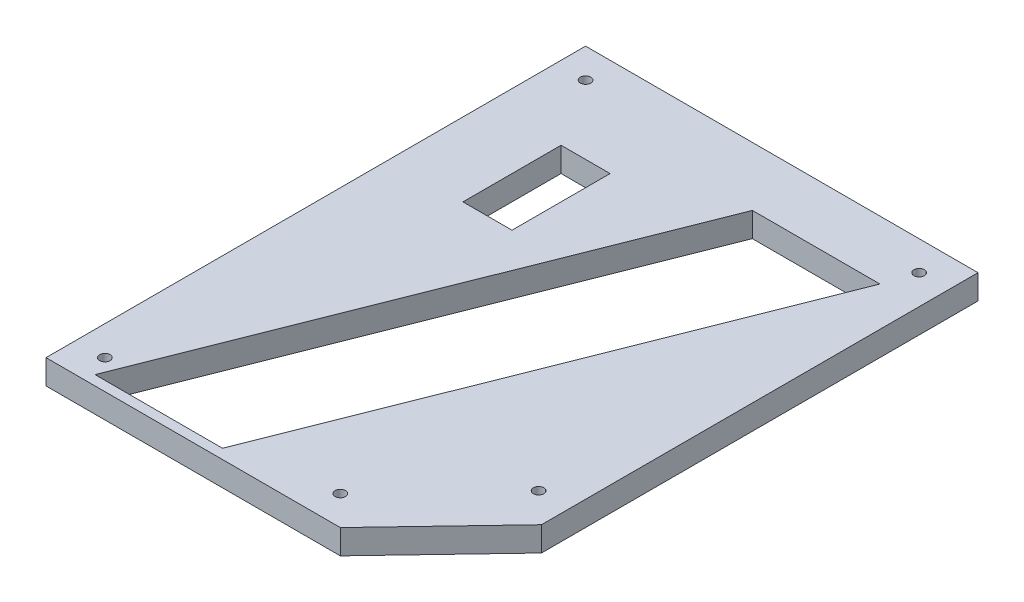
from build123d import *

# Parameters (mm, degrees)
SKETCH1_W               = 101.6
SKETCH1_H               = 139.7
BOSS_EXTRUDE1_DEPTH     = 6.35
CUT_EXTRUDE1_DEPTH      = 92.800885072
CUT_EXTRUDE4_DEPTH      = 92.800885072
CUT_EXTRUDE4_DEPTH_BACK = 6.35
CUT_EXTRUDE5_DEPTH      = 6.35
SKETCH11_W              = 12.7
SKETCH11_H              = 25.4
CUT_EXTRUDE6_DEPTH      = 6.35
SKETCH12_R              = 1.35255
CUT_EXTRUDE7_DEPTH      = 92.800885072


with BuildPart() as part:
    # Sketch1 → Boss-Extrude1 (new body)
    with BuildSketch(Plane(origin=(0, 0, 0), x_dir=(1, 0, 0), z_dir=(0, 1, 0))):
        with Locations((0, 6.35)):
            Rectangle(SKETCH1_W, SKETCH1_H)
    extrude(amount=BOSS_EXTRUDE1_DEPTH)

    # Sketch3 → Cut-Extrude1 (cut, through all)
    with BuildSketch(Plane(origin=(0, 6.35, 0), x_dir=(1, 0, 0), z_dir=(0, 1, 0))):
        with BuildLine():
            Line((-1.486564617, 31.962640907), (30.263435383, 59.140640907))
            ThreePointArc((30.263435383, 59.140640907), (33.486640907, 58.890564617), (33.236564617, 55.667359093))
            Line((33.236564617, 55.667359093), (1.486564617, 28.489359093))
            ThreePointArc((1.486564617, 28.489359093), (-1.736640907, 28.739435383), (-1.486564617, 31.962640907))
        make_face()
        with BuildLine():
            Line((1.486564617, -31.962640907), (-30.263435383, -59.140640907))
            ThreePointArc((-30.263435383, -59.140640907), (-33.486640907, -58.890564617), (-33.236564617, -55.667359093))
            Line((-33.236564617, -55.667359093), (-1.486564617, -28.489359093))
            ThreePointArc((-1.486564617, -28.489359093), (1.736640907, -28.739435383), (1.486564617, -31.962640907))
        make_face()
    extrude(amount=-CUT_EXTRUDE1_DEPTH, mode=Mode.SUBTRACT)

    # Sketch7 → Cut-Extrude4 (cut, two sides: drawn at the far end of the back side and taken through both)
    with BuildSketch(Plane(origin=(0, 6.35, 0), x_dir=(1, 0, 0), z_dir=(0, 1, 0)).offset(-CUT_EXTRUDE4_DEPTH_BACK)):
        Polygon((277.114298269, 200.961809181), (50.8, -36.813673481), (25.4, -63.5), (-200.914298269, -301.275482661), (274.636667054, -753.904079199), (752.665263592, -251.666787357), align=None)
    extrude(amount=CUT_EXTRUDE4_DEPTH + CUT_EXTRUDE4_DEPTH_BACK, mode=Mode.SUBTRACT)

    # Sketch10 → Cut-Extrude5 (cut)
    with BuildSketch(Plane(origin=(0, 6.35, 0), x_dir=(1, 0, 0), z_dir=(0, 1, 0))):
        Polygon((-40.64, -60.96), (-7.62, -60.96), (40.64, 60.96), (7.62, 60.96), align=None)
    extrude(amount=-CUT_EXTRUDE5_DEPTH, mode=Mode.SUBTRACT)

    # Sketch11 → Cut-Extrude6 (cut)
    with BuildSketch(Plane(origin=(0, 6.35, 0), x_dir=(1, 0, 0), z_dir=(0, 1, 0))):
        with Locations((-25.4, 38.1)):
            Rectangle(SKETCH11_W, SKETCH11_H)
    extrude(amount=-CUT_EXTRUDE6_DEPTH, mode=Mode.SUBTRACT)

    # Sketch12 → Cut-Extrude7 (cut, through all)
    with BuildSketch(Plane(origin=(0, 6.35, 0), x_dir=(1, 0, 0), z_dir=(0, 1, 0))):
        with Locations(Location((-43.18, 68.58, 0), (0, 0, 270))):
            Circle(SKETCH12_R)
        with Locations(Location((43.18, 68.58, 0), (0, 0, 90))):
            Circle(SKETCH12_R)
        with Locations(Location((-43.18, -55.88, 0), (0, 0, 90))):
            Circle(SKETCH12_R)
        with Locations(Location((17.78, -55.88, 0), (0, 0, 270))):
            Circle(SKETCH12_R)
        with Locations(Location((42.813150737, -29.579101009, 0), (0, 0, 90))):
            Circle(SKETCH12_R)
    extrude(amount=-CUT_EXTRUDE7_DEPTH, mode=Mode.SUBTRACT)


solid = part.part
